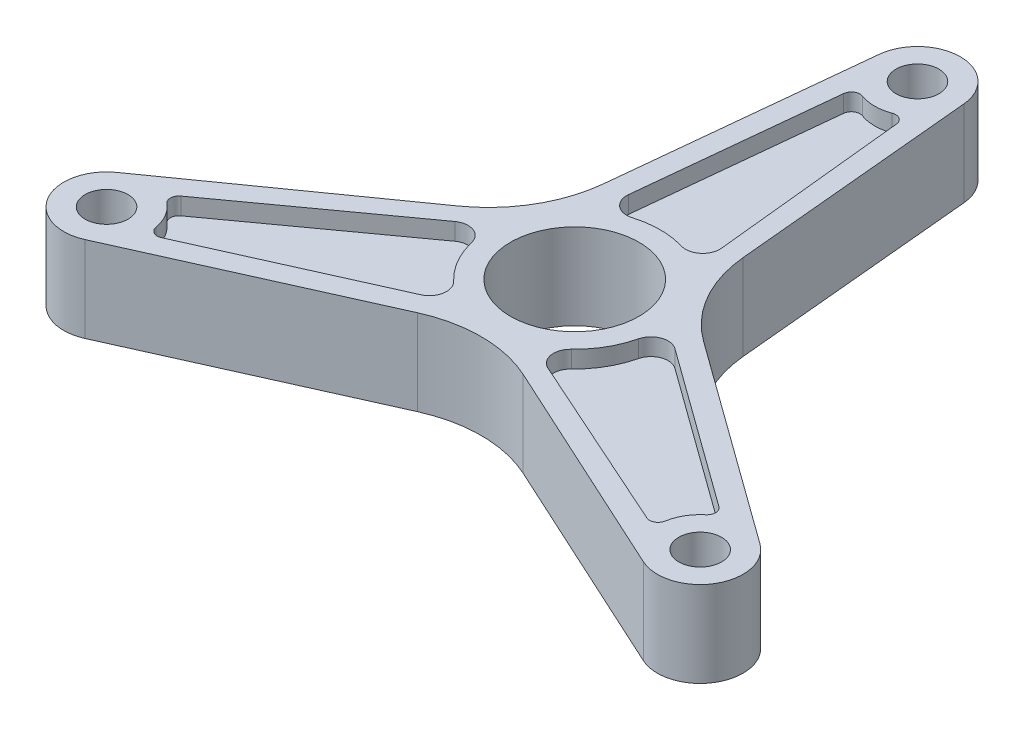
from build123d import *

# Parameters (mm, degrees)
SCHIZZO1_R                   = 15
SCHIZZO1_R_2                 = 5
ESTRUSIONE_ESTRUSIONE3_DEPTH = 10
ESTRUSIONE_ESTRUSIONE4_DEPTH = 6
RACCORDO1_R                  = 2
RACCORDO2_R                  = 4


with BuildPart() as part:
    # Schizzo1 → Estrusione-Estrusione3 (new, symmetric)
    with BuildSketch(Plane(origin=(0, 0, 0), x_dir=(1, 0, 0), z_dir=(0, 1, 0))):
        with BuildLine():
            Line((-9.947570822, 81.022660617), (-15.953490717, 22.602190996))
            ThreePointArc((-15.953490717, 22.602190996), (-19.887097519, 10.546739253), (-28.450004541, 1.193461616))
            Line((-28.450004541, 1.193461616), (-75.064098517, -31.841096257))
            ThreePointArc((-75.064098517, -31.841096257), (-77.965975808, -44.958742299), (-65.193896965, -49.126179346))
            Line((-65.193896965, -49.126179346), (-11.597326225, -25.117223738))
            ThreePointArc((-11.597326225, -25.117223738), (0.80980464, -22.496101285), (13.191434192, -25.235157478))
            Line((13.191434192, -25.235157478), (65.107247501, -49.0868681))
            ThreePointArc((65.107247501, -49.0868681), (77.918400858, -45.041144531), (75.141467788, -31.896481271))
            Line((75.141467788, -31.896481271), (27.550816942, 2.515032742))
            ThreePointArc((27.550816942, 2.515032742), (19.077292879, 11.949362033), (15.258570349, 24.041695862))
            Line((15.258570349, 24.041695862), (9.956851016, 80.927964356))
            ThreePointArc((9.956851016, 80.927964356), (0.047574951, 89.999886831), (-9.947570822, 81.022660617))
        make_face()
        Circle(SCHIZZO1_R, mode=Mode.SUBTRACT)
        with Locations((0, 80)):
            Circle(SCHIZZO1_R_2, mode=Mode.SUBTRACT)
        with Locations((69.282032303, -40)):
            Circle(SCHIZZO1_R_2, mode=Mode.SUBTRACT)
        with Locations((-69.282032303, -40)):
            Circle(SCHIZZO1_R_2, mode=Mode.SUBTRACT)
        with BuildLine():
            Line((-5.859435485, 71.896481271), (-11.573917762, 16.31086839))
            ThreePointArc((-11.573917762, 16.31086839), (0, 20), (11.573917762, 16.31086839))
            Line((11.573917762, 16.31086839), (5.859435485, 71.896481271))
            ThreePointArc((5.859435485, 71.896481271), (0, 70), (-5.859435485, 71.896481271))
        make_face(mode=Mode.SUBTRACT)
        with BuildLine():
            Line((65.193896965, -30.873820654), (19.912585265, 1.867872608))
            ThreePointArc((19.912585265, 1.867872608), (17.320508076, -10), (8.338667503, -18.178740998))
            Line((8.338667503, -18.178740998), (59.334461481, -41.022660617))
            ThreePointArc((59.334461481, -41.022660617), (60.621778265, -35), (65.193896965, -30.873820654))
        make_face(mode=Mode.SUBTRACT)
        with BuildLine():
            Line((-59.334461481, -41.022660617), (-8.338667503, -18.178740998))
            ThreePointArc((-8.338667503, -18.178740998), (-17.320508076, -10), (-19.912585265, 1.867872608))
            Line((-19.912585265, 1.867872608), (-65.193896965, -30.873820654))
            ThreePointArc((-65.193896965, -30.873820654), (-60.621778265, -35), (-59.334461481, -41.022660617))
        make_face(mode=Mode.SUBTRACT)
    extrude(amount=ESTRUSIONE_ESTRUSIONE3_DEPTH, both=True)

    # Schizzo1<2> → Estrusione-Estrusione4 (add, symmetric)
    with BuildSketch(Plane(origin=(0, 0, 0), x_dir=(1, 0, 0), z_dir=(0, 1, 0))):
        with BuildLine():
            ThreePointArc((5.859435485, 71.896481271), (0, 70), (-5.859435485, 71.896481271))
            Line((-5.859435485, 71.896481271), (-11.573917762, 16.31086839))
            ThreePointArc((-11.573917762, 16.31086839), (0, 20), (11.573917762, 16.31086839))
            Line((11.573917762, 16.31086839), (5.859435485, 71.896481271))
        make_face()
        with BuildLine():
            ThreePointArc((59.334461481, -41.022660617), (60.621778265, -35), (65.193896965, -30.873820654))
            Line((65.193896965, -30.873820654), (19.912585265, 1.867872608))
            ThreePointArc((19.912585265, 1.867872608), (17.320508076, -10), (8.338667503, -18.178740998))
            Line((8.338667503, -18.178740998), (59.334461481, -41.022660617))
        make_face()
        with BuildLine():
            ThreePointArc((-65.193896965, -30.873820654), (-60.621778265, -35), (-59.334461481, -41.022660617))
            Line((-59.334461481, -41.022660617), (-8.338667503, -18.178740998))
            ThreePointArc((-8.338667503, -18.178740998), (-17.320508076, -10), (-19.912585265, 1.867872608))
            Line((-19.912585265, 1.867872608), (-65.193896965, -30.873820654))
        make_face()
    extrude(amount=ESTRUSIONE_ESTRUSIONE4_DEPTH, both=True)

    # Raccordo1
    raccordo1_edges = [part.edges().sort_by_distance(p)[0] for p in [
        (-59.334461481, -8, 41.022660617),
        (-65.193896965, -8, 30.873820654),
        (-59.334461481, 8, 41.022660617),
        (-65.193896965, 8, 30.873820654),
        (65.193896965, 8, 30.873820654),
        (59.334461481, 8, 41.022660617),
        (59.334461481, -8, 41.022660617),
        (65.193896965, -8, 30.873820654),
        (-5.859435485, -8, -71.896481271),
        (-5.859435485, 8, -71.896481271),
        (5.859435485, 8, -71.896481271),
        (5.859435485, -8, -71.896481271),
    ]]
    fillet(raccordo1_edges, radius=RACCORDO1_R)

    # Raccordo2
    raccordo2_edges = [part.edges().sort_by_distance(p)[0] for p in [
        (-19.912585265, -8, -1.867872608),
        (-11.573917762, -8, -16.31086839),
        (11.573917762, -8, -16.31086839),
        (-8.338667503, -8, 18.178740998),
        (19.912585265, -8, -1.867872608),
        (8.338667503, -8, 18.178740998),
        (-11.573917762, 8, -16.31086839),
        (-8.338667503, 8, 18.178740998),
        (-19.912585265, 8, -1.867872608),
        (8.338667503, 8, 18.178740998),
        (19.912585265, 8, -1.867872608),
        (11.573917762, 8, -16.31086839),
    ]]
    fillet(raccordo2_edges, radius=RACCORDO2_R)


solid = part.part
